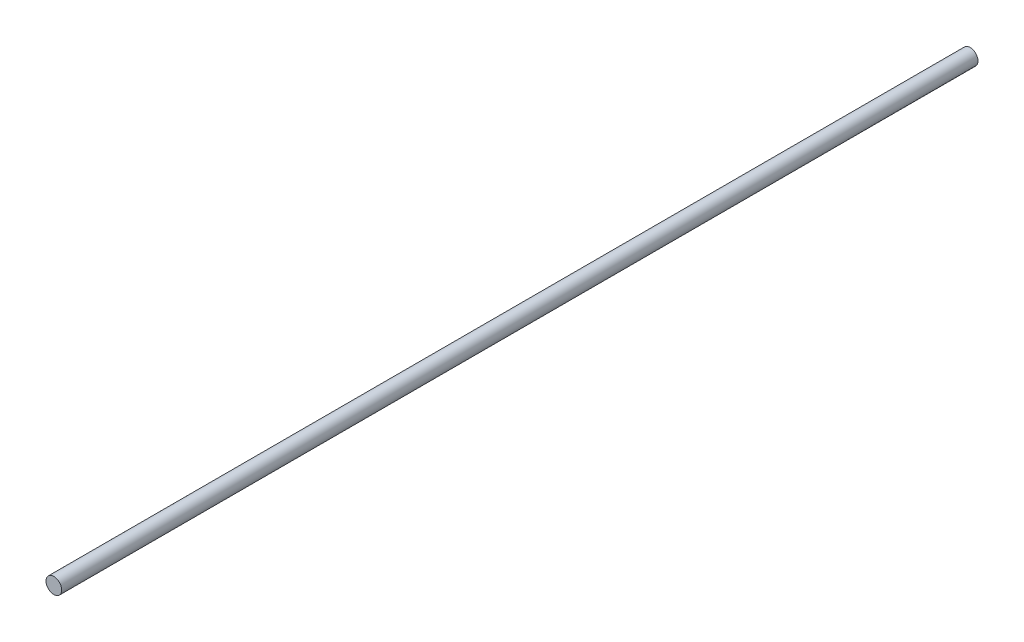
from build123d import *

# Parameters (mm, degrees)
ESQUISSE1_R        = 3
BOSS_EXTRU_1_DEPTH = 350


with BuildPart() as part:
    # Esquisse1 → Boss.-Extru.1 (new body)
    with BuildSketch(Plane.XY):
        Circle(ESQUISSE1_R)
    extrude(amount=BOSS_EXTRU_1_DEPTH)


solid = part.part
